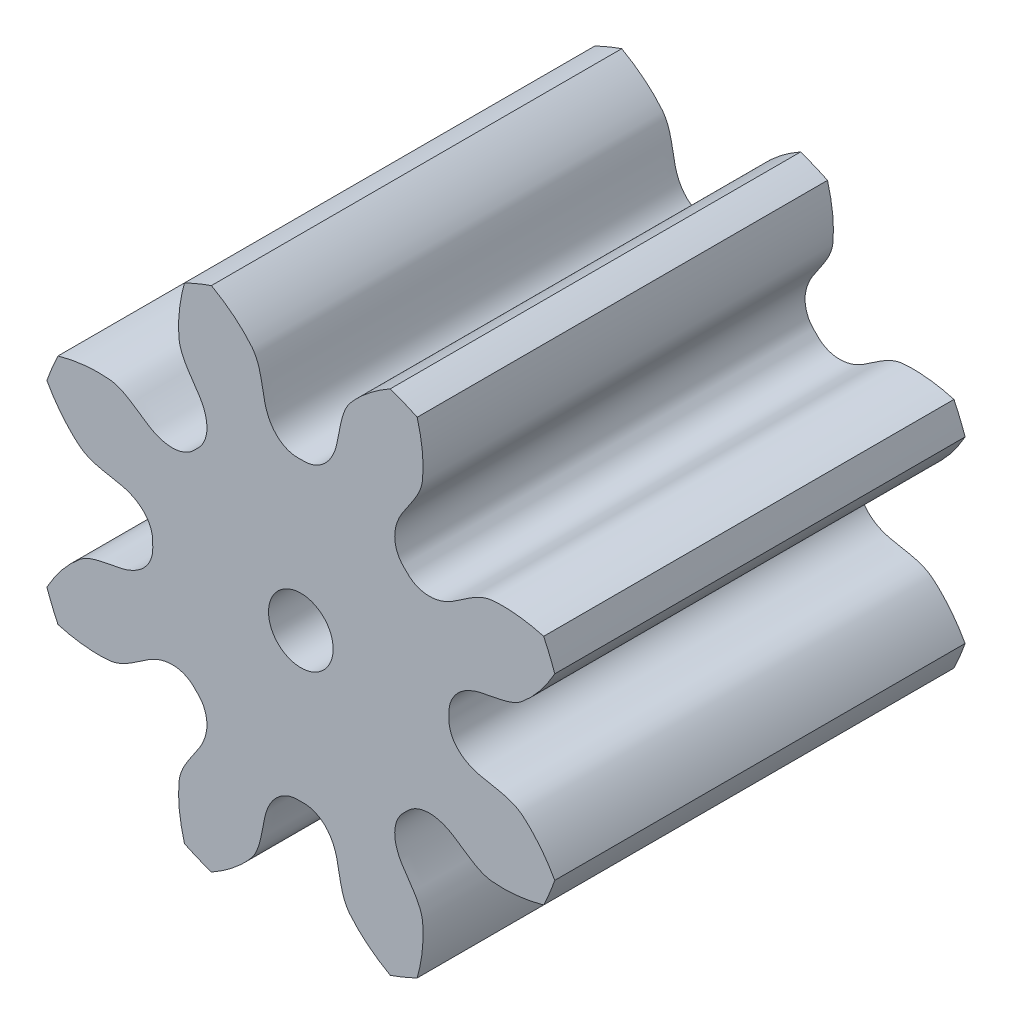
from build123d import *

# Parameters (mm, degrees)
SKETCHREVOLVESPURGEAR1_W       = 19.05
SKETCHREVOLVESPURGEAR1_H       = 12.499999812
TOOTHEXTRUDECUTSPURGEAR1_DEPTH = 9.525
PATTERNSPURGEAR1_COUNT         = 8
BOREREVOLVESKETCH_W            = 19.05
BOREREVOLVESKETCH_H            = 1.5
SCALE_1_SCALE                  = 0.2


with BuildPart() as part:
    # SketchRevolveSpurGear1 → SpurGear1 (revolve)
    with BuildSketch(Plane(origin=(0, 0, 0), x_dir=(0, 0, -1), z_dir=(1, 0, 0))):
        with Locations((0, 6.249999906)):
            Rectangle(SKETCHREVOLVESPURGEAR1_W, SKETCHREVOLVESPURGEAR1_H)
    revolve(axis=Axis((0, 0, 0), (0, 0, -1)))

    # SketchToothSpurGear1 → ToothExtrudeCutSpurGear1 (cut, symmetric)
    with BuildSketch(Plane.XY):
        with BuildLine():
            ThreePointArc((11.870789143, 4.298253754), (12.62499981, 0), (11.870789143, -4.298253754))
            add(Edge.make_bspline(
                [(11.870789143, -4.298253754), (11.705373466, -3.989903778), (11.466131585, -3.602884898), (11.132929162, -3.163175269), (10.945561236, -2.93760931), (10.76094687, -2.734796713), (10.580972796, -2.553396581), (10.40633248, -2.3946055), (9.752715321, -1.824613648), (8.869483929, -1.8283735), (8.172499607, -1.629803137), (8.151851011, -1.623719337), (8.131286356, -1.617473449), (8.110804149, -1.611059626), (8.090405079, -1.604478042), (8.070089275, -1.597727197), (8.049857042, -1.590805972), (8.029708669, -1.583713076), (8.009644479, -1.576447198), (7.989664822, -1.569006961), (7.969770079, -1.561390932), (7.949960662, -1.553597623), (7.930237023, -1.545625483), (7.910599648, -1.537472904), (7.891049069, -1.529138218), (7.87158586, -1.520619694), (7.852210645, -1.511915538), (7.8329241, -1.503023896), (7.813726957, -1.493942849), (7.794620007, -1.484670416), (7.775604106, -1.475204551), (7.756680177, -1.465543144), (7.737849217, -1.455684024), (7.719112299, -1.445624953), (7.700470581, -1.435363633), (7.681925307, -1.424897702), (7.663477813, -1.414224739), (7.645129535, -1.403342262), (7.626882012, -1.392247729), (7.608736896, -1.380938544), (7.590695953, -1.369412055), (7.572761072, -1.35766556), (7.554934272, -1.345696307), (7.537217709, -1.333501499), (7.51961368, -1.321078297), (7.502124634, -1.308423826), (7.484753176, -1.295535178), (7.467502077, -1.282409418), (7.450374279, -1.269043591), (7.433372903, -1.255434728), (7.416501258, -1.241579853), (7.399762848, -1.227475992), (7.383161377, -1.213120182), (7.366700759, -1.198509477), (7.350385125, -1.183640964), (7.334218828, -1.168511771), (7.318206453, -1.15311908), (7.30235282, -1.137460137), (7.286662991, -1.12153227), (7.271142276, -1.105332904), (7.25579624, -1.088859571), (7.240630702, -1.072109933), (7.225651744, -1.055081797), (7.21086571, -1.037773131), (7.196279208, -1.020182088), (7.181899115, -1.002307022), (7.16773257, -0.984146511), (7.153786976, -0.96569938), (7.140069997, -0.946964719), (7.126589551, -0.92794191), (7.113353806, -0.908630648), (7.100371171, -0.889030966), (7.087650286, -0.869143259), (7.075200008, -0.848968307), (7.063029401, -0.828507299), (7.051147719, -0.807761858), (7.039564386, -0.786734061), (7.028288975, -0.765426468), (7.01733119, -0.743842135), (7.006700835, -0.72198464), (6.996407793, -0.699858102), (6.986461992, -0.677467196), (6.976873374, -0.654817168), (6.967651866, -0.631913852), (6.958807339, -0.608763676), (6.950349575, -0.585373675), (6.942288226, -0.561751491), (6.934632776, -0.537905379), (6.927392498, -0.513844203), (6.920576414, -0.489577434), (6.914193253, -0.465115137), (6.908251408, -0.440467961), (6.902758894, -0.415647124), (6.897723306, -0.390664389), (6.893151782, -0.365532044), (6.889050959, -0.340262866), (6.88542694, -0.3148701), (6.882285263, -0.289367414), (6.879630838, -0.263768863), (6.877468041, -0.238088846), (6.875800231, -0.212342069), (6.874631425, -0.186543457), (6.873959938, -0.160708261), (6.873817609, -0.137396468), (6.874301667, -0.083826382), (6.87560374, 0), (6.874301667, 0.083826382), (6.873817609, 0.137396468), (6.873959938, 0.160708261), (6.874631425, 0.186543457), (6.875800231, 0.212342069), (6.877468041, 0.238088846), (6.879630838, 0.263768863), (6.882285263, 0.289367414), (6.88542694, 0.3148701), (6.889050959, 0.340262866), (6.893151782, 0.365532044), (6.897723306, 0.390664389), (6.902758894, 0.415647124), (6.908251408, 0.440467961), (6.914193253, 0.465115137), (6.920576414, 0.489577434), (6.927392498, 0.513844203), (6.934632776, 0.537905379), (6.942288226, 0.561751491), (6.950349575, 0.585373675), (6.958807339, 0.608763676), (6.967651866, 0.631913852), (6.976873374, 0.654817168), (6.986461992, 0.677467196), (6.996407793, 0.699858102), (7.006700835, 0.72198464), (7.01733119, 0.743842135), (7.028288975, 0.765426468), (7.039564386, 0.786734061), (7.051147719, 0.807761858), (7.063029401, 0.828507299), (7.075200008, 0.848968307), (7.087650286, 0.869143259), (7.100371171, 0.889030966), (7.113353806, 0.908630648), (7.126589551, 0.92794191), (7.140069997, 0.946964719), (7.153786976, 0.96569938), (7.16773257, 0.984146511), (7.181899115, 1.002307022), (7.196279208, 1.020182088), (7.21086571, 1.037773131), (7.225651744, 1.055081797), (7.240630702, 1.072109933), (7.25579624, 1.088859571), (7.271142276, 1.105332904), (7.286662991, 1.12153227), (7.30235282, 1.137460137), (7.318206453, 1.15311908), (7.334218828, 1.168511771), (7.350385125, 1.183640964), (7.366700759, 1.198509477), (7.383161377, 1.213120182), (7.399762848, 1.227475992), (7.416501258, 1.241579853), (7.433372903, 1.255434728), (7.450374279, 1.269043591), (7.467502077, 1.282409418), (7.484753176, 1.295535178), (7.502124634, 1.308423826), (7.51961368, 1.321078297), (7.537217709, 1.333501499), (7.554934272, 1.345696307), (7.572761072, 1.35766556), (7.590695953, 1.369412055), (7.608736896, 1.380938544), (7.626882012, 1.392247729), (7.645129535, 1.403342262), (7.663477813, 1.414224739), (7.681925307, 1.424897702), (7.700470581, 1.435363633), (7.719112299, 1.445624953), (7.737849217, 1.455684024), (7.756680177, 1.465543144), (7.775604106, 1.475204551), (7.794620007, 1.484670416), (7.813726957, 1.493942849), (7.8329241, 1.503023896), (7.852210645, 1.511915538), (7.87158586, 1.520619694), (7.891049069, 1.529138218), (7.910599648, 1.537472904), (7.930237023, 1.545625483), (7.949960662, 1.553597623), (7.969770079, 1.561390932), (7.989664822, 1.569006961), (8.009644479, 1.576447198), (8.029708669, 1.583713076), (8.049857042, 1.590805972), (8.070089275, 1.597727197), (8.090405079, 1.604478042), (8.110804149, 1.611059626), (8.131286356, 1.617473449), (8.151851011, 1.623719337), (8.172499607, 1.629803137), (8.869483929, 1.8283735), (9.752715321, 1.824613648), (10.40633248, 2.3946055), (10.580972796, 2.553396581), (10.76094687, 2.734796713), (10.945561236, 2.93760931), (11.132929162, 3.163175269), (11.466131585, 3.602884898), (11.705373466, 3.989903778), (11.870789143, 4.298253754)],
                knots=[0, 0, 0, 0, 0.074362536, 0.096474121, 0.11724561, 0.136677004, 0.154768301, 0.171519502, 0.186930608, 0.337992419, 0.339519997, 0.341045219, 0.3425682, 0.34408906, 0.345607918, 0.347124896, 0.34864012, 0.350153717, 0.351665818, 0.353176553, 0.354686058, 0.356194471, 0.35770193, 0.359208579, 0.360714562, 0.362220025, 0.36372512, 0.365229998, 0.366734814, 0.368239725, 0.369744891, 0.371250474, 0.372756638, 0.37426355, 0.375771379, 0.377280296, 0.378790475, 0.380302091, 0.38181532, 0.383330343, 0.38484734, 0.386366493, 0.387887986, 0.389412003, 0.390938732, 0.392468359, 0.394001071, 0.395537057, 0.397076505, 0.398619602, 0.400166537, 0.401717496, 0.403272666, 0.40483223, 0.406396372, 0.407965272, 0.409539107, 0.411118054, 0.412702283, 0.414291961, 0.415887251, 0.417488311, 0.419095292, 0.420708339, 0.422327593, 0.423953183, 0.425585234, 0.427223858, 0.428869161, 0.430521238, 0.432180171, 0.433846034, 0.435518885, 0.437198773, 0.438885731, 0.440579778, 0.442280919, 0.443989142, 0.445704421, 0.447426712, 0.449155956, 0.450892074, 0.45263497, 0.454384532, 0.456140627, 0.457903105, 0.459671798, 0.461446518, 0.46322706, 0.4650132, 0.466804697, 0.468601293, 0.470402712, 0.472208662, 0.474018836, 0.475832913, 0.477650558, 0.479471424, 0.48129515, 0.483121367, 0.484949698, 0.486779757, 0.488611151, 0.490443484, 0.491735334, 0.5, 0.508264666, 0.509556516, 0.511388849, 0.513220243, 0.515050302, 0.516878633, 0.51870485, 0.520528576, 0.522349442, 0.524167087, 0.525981164, 0.527791338, 0.529597288, 0.531398707, 0.533195303, 0.5349868, 0.53677294, 0.538553482, 0.540328202, 0.542096895, 0.543859373, 0.545615468, 0.54736503, 0.549107926, 0.550844044, 0.552573288, 0.554295579, 0.556010858, 0.557719081, 0.559420222, 0.561114269, 0.562801227, 0.564481115, 0.566153966, 0.567819829, 0.569478762, 0.571130839, 0.572776142, 0.574414766, 0.576046817, 0.577672407, 0.579291661, 0.580904708, 0.582511689, 0.584112749, 0.585708039, 0.587297717, 0.588881946, 0.590460893, 0.592034728, 0.593603628, 0.59516777, 0.596727334, 0.598282504, 0.599833463, 0.601380398, 0.602923495, 0.604462943, 0.605998929, 0.607531641, 0.609061268, 0.610587997, 0.612112014, 0.613633507, 0.61515266, 0.616669657, 0.61818468, 0.619697909, 0.621209525, 0.622719704, 0.624228621, 0.62573645, 0.627243362, 0.628749526, 0.630255109, 0.631760275, 0.633265186, 0.634770002, 0.63627488, 0.637779975, 0.639285438, 0.640791421, 0.64229807, 0.643805529, 0.645313942, 0.646823447, 0.648334182, 0.649846283, 0.65135988, 0.652875104, 0.654392082, 0.65591094, 0.6574318, 0.658954781, 0.660480003, 0.662007581, 0.813069392, 0.828480498, 0.845231699, 0.863322996, 0.88275439, 0.903525879, 0.925637464, 1, 1, 1, 1], degree=3))
        make_face()
    toothextrudecutspurgear1 = extrude(amount=TOOTHEXTRUDECUTSPURGEAR1_DEPTH, both=True, mode=Mode.SUBTRACT)

    # PatternSpurGear1: ToothExtrudeCutSpurGear1 ×8 about axis
    patternspurgear1_axis = Axis((0, 0, 55), (0, 0, -1))
    for i in range(1, PATTERNSPURGEAR1_COUNT):
        add(toothextrudecutspurgear1.rotate(patternspurgear1_axis, i * 360 / PATTERNSPURGEAR1_COUNT), mode=Mode.SUBTRACT)

    # BoreRevolveSketch → BoreRevolveCut (revolve, cut)
    with BuildSketch(Plane(origin=(0, 0, 0), x_dir=(0, 0, -1), z_dir=(1, 0, 0))):
        with Locations((0, 0.75)):
            Rectangle(BOREREVOLVESKETCH_W, BOREREVOLVESKETCH_H)
    revolve(axis=Axis((0, 0, 0), (0, 0, -1)), mode=Mode.SUBTRACT)


with BuildPart() as part_1:
    # 缩放比例1: scaled about (0, 0, 0)
    add(part.part.scale(SCALE_1_SCALE))


solid = part_1.part
